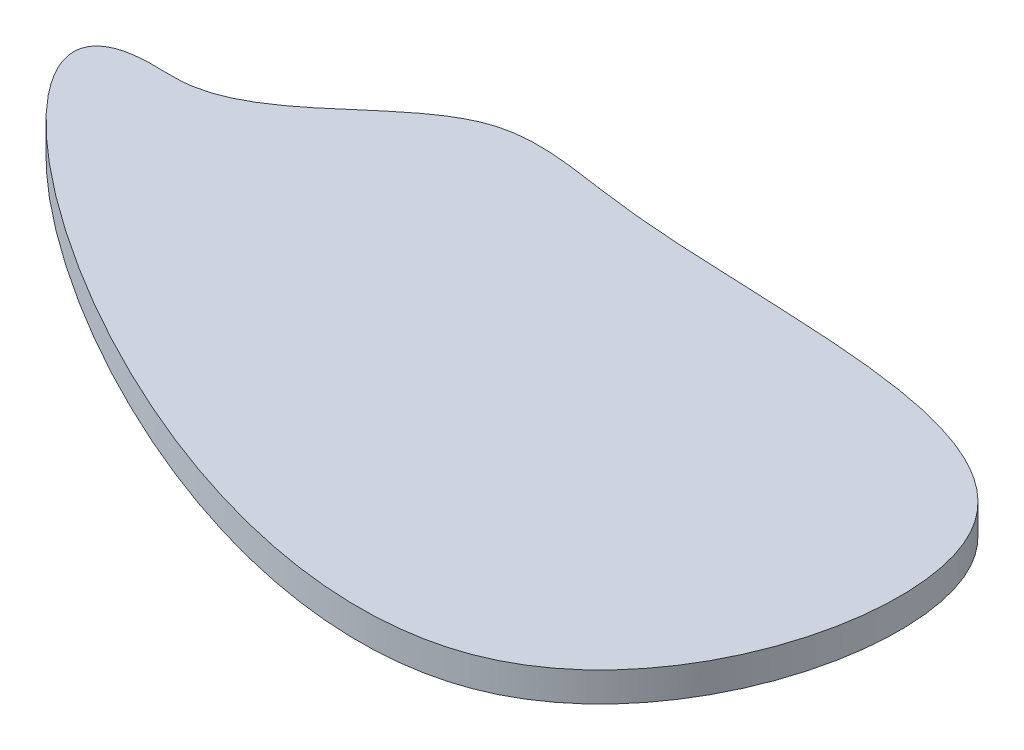
from build123d import *

# Parameters (mm, degrees)
BOSS_EXTRUDE1_DEPTH = 10


with BuildPart() as part:
    # Sketch1 → Boss-Extrude1 (new body)
    with BuildSketch(Plane(origin=(0, 0, 0), x_dir=(1, 0, 0), z_dir=(0, 1, 0))):
        with BuildLine():
            add(Edge.make_bspline(
                [(0, 0), (26.045178624, 1.796186447), (52.46264174, 49.680046202), (147.789046441, 28.015794369), (306.264533079, 51.62643922), (229.974546665, -233.770498352), (-96.890843664, 5.840597094), (-3.169729897, -0.218598074), (0, 0)],
                knots=[0, 0, 0, 0, 0.113907502, 0.176114574, 0.417374333, 0.606583846, 0.986137319, 1, 1, 1, 1], degree=3))
        make_face()
    extrude(amount=BOSS_EXTRUDE1_DEPTH)


solid = part.part
